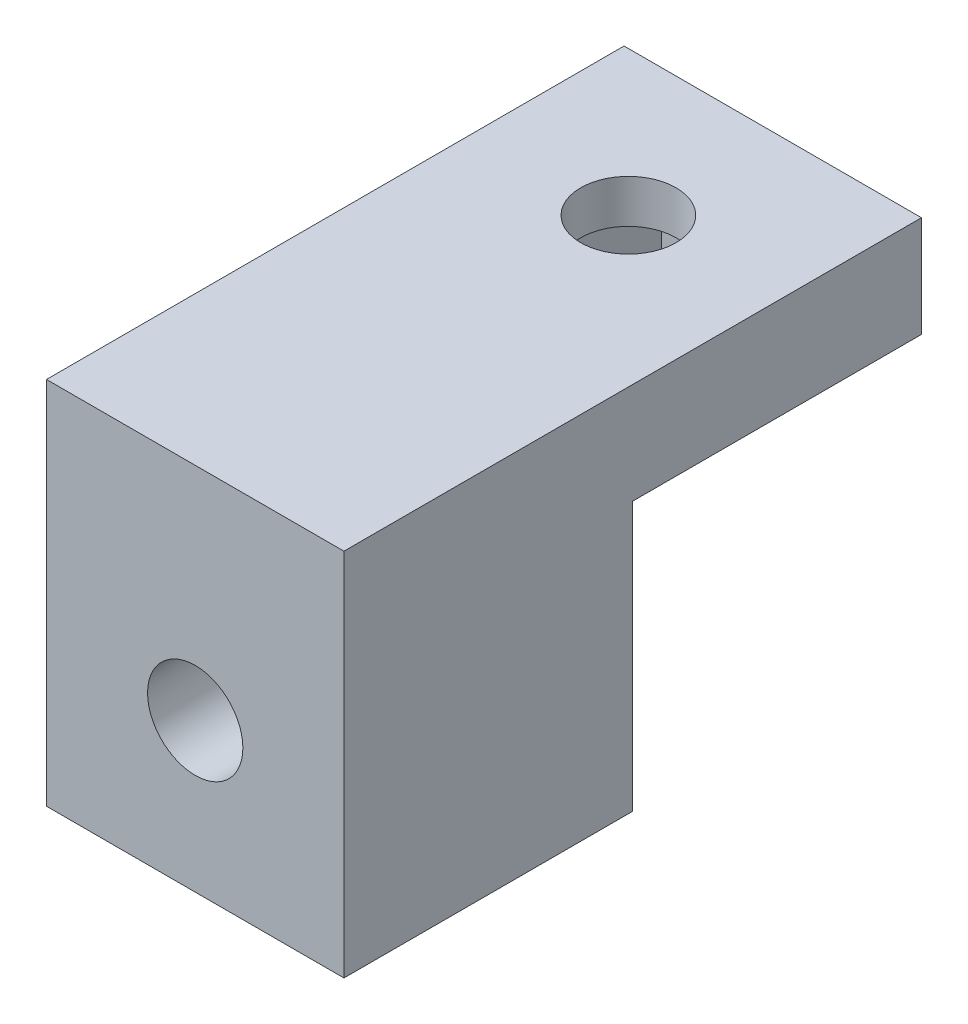
from build123d import *

# Parameters (mm, degrees)
SKETCH1_W           = 10.3
SKETCH1_H           = 12.8
SKETCH1_R           = 1.65
BOSS_EXTRUDE2_DEPTH = 5
SKETCH2_R           = 1.65
CUT_EXTRUDE1_DEPTH  = 2
SKETCH3_W           = 10.3
SKETCH3_H           = 3.5
BOSS_EXTRUDE3_DEPTH = 10
CUT_EXTRUDE2_DEPTH  = 2
SKETCH5_R           = 1.65
CUT_EXTRUDE3_DEPTH  = 1.5


with BuildPart() as part:
    # Sketch1 → Boss-Extrude2 (new, symmetric)
    with BuildSketch(Plane.XY):
        with Locations((0, 1.25)):
            Rectangle(SKETCH1_W, SKETCH1_H)
        Circle(SKETCH1_R, mode=Mode.SUBTRACT)
    extrude(amount=BOSS_EXTRUDE2_DEPTH, both=True)

    # Sketch2 → Cut-Extrude1 (cut)
    with BuildSketch(Plane(origin=(0, 0, -5), x_dir=(-1, 0, 0), z_dir=(0, 0, -1))):
        Polygon((-1.65, -2.8), (1.65, -2.8), (3.39642492, 0), (1.65, 2.8), (-1.65, 2.8), (-3.39642492, 0), align=None)
        Circle(SKETCH2_R, mode=Mode.SUBTRACT)
    extrude(amount=-CUT_EXTRUDE1_DEPTH, mode=Mode.SUBTRACT)

    # Sketch3 → Boss-Extrude3 (add)
    with BuildSketch(Plane(origin=(0, 0, -5), x_dir=(-1, 0, 0), z_dir=(0, 0, -1))):
        with Locations((0, 5.9)):
            Rectangle(SKETCH3_W, SKETCH3_H)
    extrude(amount=BOSS_EXTRUDE3_DEPTH)

    # Sketch4 → Cut-Extrude2 (cut)
    with BuildSketch(Plane.XZ.offset(-4.15)):
        with BuildLine():
            Line((-1.65, -10), (-3.39642492, -10))
            Line((-3.39642492, -10), (-1.65, -12.8))
            Line((-1.65, -12.8), (1.65, -12.8))
            Line((1.65, -12.8), (3.39642492, -10))
            Line((3.39642492, -10), (1.65, -10))
            ThreePointArc((1.65, -10), (0, -11.65), (-1.65, -10))
        make_face()
        with BuildLine():
            Line((-1.65, -7.2), (-3.39642492, -10))
            Line((-3.39642492, -10), (-1.65, -10))
            ThreePointArc((-1.65, -10), (0, -8.35), (1.65, -10))
            Line((1.65, -10), (3.39642492, -10))
            Line((3.39642492, -10), (1.65, -7.2))
            Line((1.65, -7.2), (-1.65, -7.2))
        make_face()
        with BuildLine():
            ThreePointArc((1.65, -10), (0, -8.35), (-1.65, -10))
            Line((-1.65, -10), (1.65, -10))
        make_face()
        with BuildLine():
            Line((1.65, -10), (-1.65, -10))
            ThreePointArc((-1.65, -10), (0, -11.65), (1.65, -10))
        make_face()
    extrude(amount=-CUT_EXTRUDE2_DEPTH, mode=Mode.SUBTRACT)

    # Sketch5 → Cut-Extrude3 (cut)
    with BuildSketch(Plane.XZ.offset(-6.15)):
        with Locations(Location((0, -10, 0), (0, 0, 270))):
            Circle(SKETCH5_R)
    extrude(amount=-CUT_EXTRUDE3_DEPTH, mode=Mode.SUBTRACT)


solid = part.part
